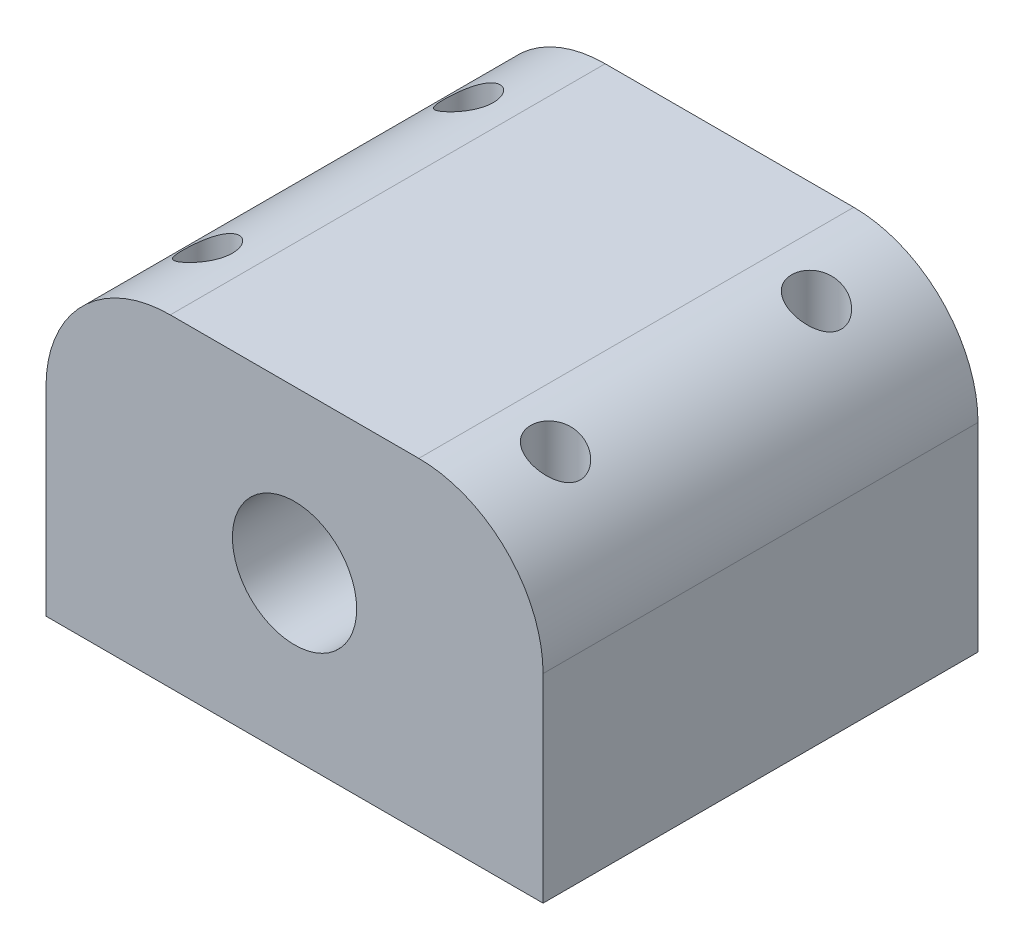
from build123d import *

# Parameters (mm, degrees)
SKETCH1_W           = 40
SKETCH1_H           = 26
BOSS_EXTRUDE1_DEPTH = 35
SKETCH2_R           = 5
CUT_EXTRUDE1_DEPTH  = 45
FILLET1_R           = 10
SKETCH3_R           = 2
CUT_EXTRUDE2_DEPTH  = 26


with BuildPart() as part:
    # Sketch1 → Boss-Extrude1 (new body)
    with BuildSketch(Plane.XY):
        with Locations((10.325, 8.8)):
            Rectangle(SKETCH1_W, SKETCH1_H)
    extrude(amount=BOSS_EXTRUDE1_DEPTH)

    # Sketch2 → Cut-Extrude1 (cut)
    with BuildSketch(Plane.XY.offset(35)):
        with Locations((10.325, 8.8)):
            Circle(SKETCH2_R)
    extrude(amount=-CUT_EXTRUDE1_DEPTH, mode=Mode.SUBTRACT)

    # Fillet1
    fillet1_edges = [part.edges().sort_by_distance(p)[0] for p in [
        (30.325, 21.8, 17.5),
        (-9.675, 21.8, 17.5),
    ]]
    fillet(fillet1_edges, radius=FILLET1_R)

    # Sketch3 → Cut-Extrude2 (cut)
    with BuildSketch(Plane(origin=(0, 21.8, 0), x_dir=(1, 0, 0), z_dir=(0, 1, 0))):
        with Locations(Location((-3.675, -7, 0), (0, 0, 180))):
            Circle(SKETCH3_R)
        with Locations(Location((24.325, -7, 0), (0, 0, 180))):
            Circle(SKETCH3_R)
        with Locations(Location((-3.675, -28, 0), (0, 0, 180))):
            Circle(SKETCH3_R)
        with Locations(Location((24.325, -28, 0), (0, 0, 180))):
            Circle(SKETCH3_R)
    extrude(amount=-CUT_EXTRUDE2_DEPTH, mode=Mode.SUBTRACT)


solid = part.part
